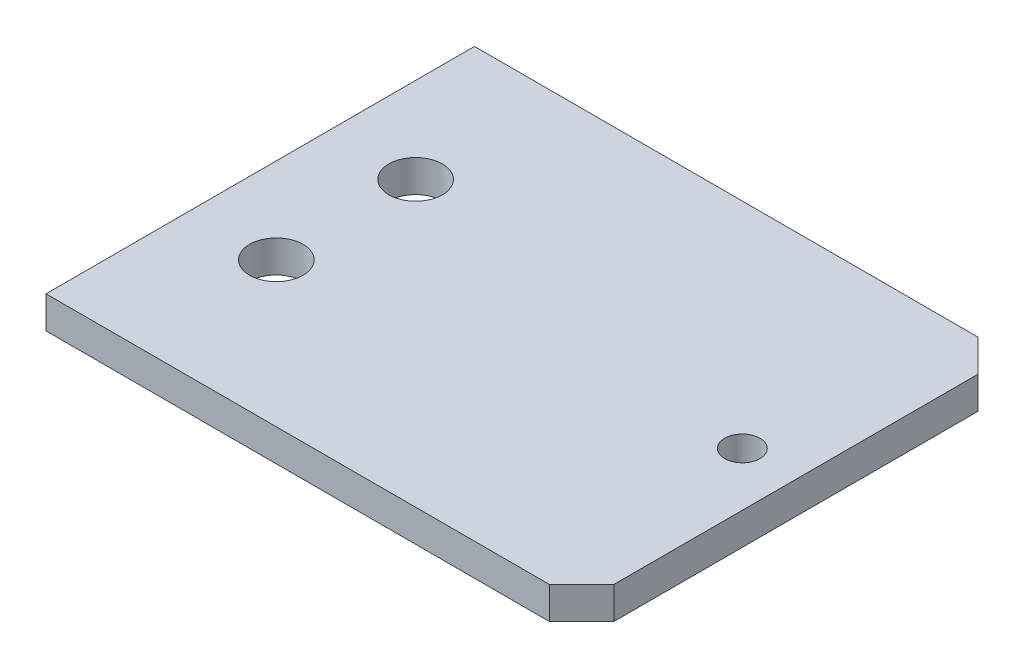
from build123d import *

# Parameters (mm, degrees)
BOSS_EXTRUDE1_DEPTH   = 3
M4X0_7_TAPPED_HOLE1_D = 3.3
M6X1_0_TAPPED_HOLE2_D = 5


with BuildPart() as part:
    # Sketch1 → Boss-Extrude1 (new body)
    with BuildSketch(Plane(origin=(0, 0, 0), x_dir=(1, 0, 0), z_dir=(0, 1, 0))):
        Polygon((47, 40), (50, 37), (50, 3), (47, 0), (0, 0), (0, 40), align=None)
    extrude(amount=-BOSS_EXTRUDE1_DEPTH)

    # M4x0.7 Tapped Hole1 (through all)
    with Locations(Plane(origin=(0, 0, 0), x_dir=(1, 0, 0), z_dir=(0, 1, 0))):
        with Locations((45, 20)):
            Hole(M4X0_7_TAPPED_HOLE1_D / 2)

    # M6x1.0 Tapped Hole2 (through all)
    with Locations(Plane(origin=(0, 0, 0), x_dir=(1, 0, 0), z_dir=(0, 1, 0))):
        with Locations((8, 13.5), (8, 26.5)):
            Hole(M6X1_0_TAPPED_HOLE2_D / 2)


solid = part.part
